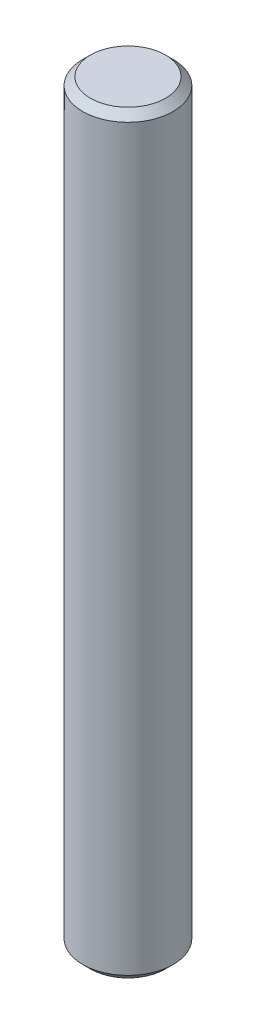
from build123d import *


with BuildPart() as part:
    # Sketch1 → Revolve1 (revolve)
    with BuildSketch(Plane(origin=(0, 0, 0), x_dir=(-1, 0, 0), z_dir=(0, 0, -1)), mode=Mode.PRIVATE) as revolve1_sk:
        Polygon((-2.48819, 0), (0, 0), (0, 50), (-2.48819, 50), (-2.99619, 49.492), (-2.99619, 0.508), align=None)
    revolve(revolve1_sk.sketch.rotate(Axis((0, 0, 0), (0, 1, 0)), 180), axis=Axis((0, 0, 0), (0, 1, 0)))


solid = part.part
